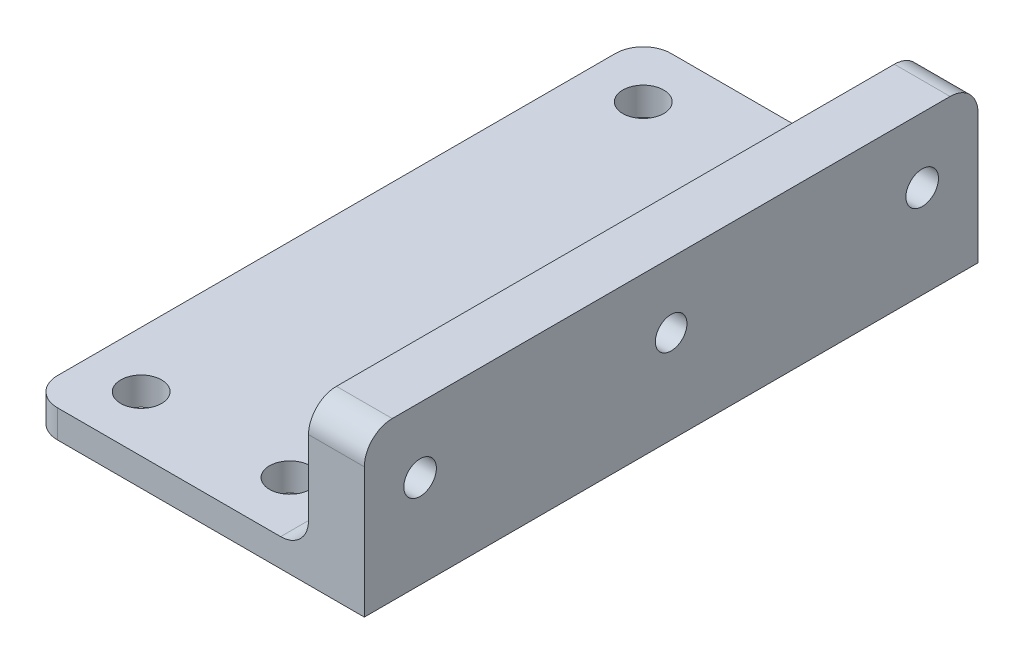
from build123d import *

# Parameters (mm, degrees)
SKETCH1_W           = 36
SKETCH1_H           = 66
SKETCH1_R           = 2.2
BOSS_EXTRUDE1_DEPTH = 3
SKETCH2_W           = 6
SKETCH2_H           = 66
BOSS_EXTRUDE2_DEPTH = 14
SKETCH3_R           = 1.7
SKETCH3_R_2         = 1.752037124
CUT_EXTRUDE1_DEPTH  = 75.464756765
CHAMFER1_SIZE       = 1.7
FILLET1_R           = 3


with BuildPart() as part:
    # Sketch1 → Boss-Extrude1 (new body)
    with BuildSketch(Plane(origin=(0, 0, 0), x_dir=(1, 0, 0), z_dir=(0, 1, 0))):
        with Locations((18, 33)):
            Rectangle(SKETCH1_W, SKETCH1_H)
        with Locations(Location((6, 60, 0), (0, 0, 270))):
            Circle(SKETCH1_R, mode=Mode.SUBTRACT)
        with Locations(Location((6, 6, 0), (0, 0, 90))):
            Circle(SKETCH1_R, mode=Mode.SUBTRACT)
        with Locations(Location((22, 6, 0), (0, 0, 270))):
            Circle(SKETCH1_R, mode=Mode.SUBTRACT)
        with Locations(Location((22, 60, 0), (0, 0, 90))):
            Circle(SKETCH1_R, mode=Mode.SUBTRACT)
    extrude(amount=BOSS_EXTRUDE1_DEPTH)

    # Sketch2 → Boss-Extrude2 (add)
    with BuildSketch(Plane(origin=(0, 3, 0), x_dir=(1, 0, 0), z_dir=(0, 1, 0))):
        with Locations((33, 33)):
            Rectangle(SKETCH2_W, SKETCH2_H)
    extrude(amount=BOSS_EXTRUDE2_DEPTH)

    # Sketch3 → Cut-Extrude1 (cut, through all)
    with BuildSketch(Plane.ZY.offset(-30)):
        with Locations((-33, 10)):
            Circle(SKETCH3_R)
        with Locations((-6, 10)):
            Circle(SKETCH3_R_2)
        with Locations(Location((-60, 10, 0), (0, 0, 180))):
            Circle(SKETCH3_R_2)
    extrude(amount=-CUT_EXTRUDE1_DEPTH, mode=Mode.SUBTRACT)

    # Chamfer1
    chamfer1_edges = [part.edges().sort_by_distance(p)[0] for p in [
        (30, 10, -58.247962876),
        (30, 10, -7.752037124),
        (30, 10, -34.7),
    ]]
    chamfer(chamfer1_edges, length=CHAMFER1_SIZE)

    # Fillet1
    fillet1_edges = [part.edges().sort_by_distance(p)[0] for p in [
        (30, 3, -33),
        (33, 17, -66),
        (33, 17, 0),
        (0, 1.5, -66),
        (0, 1.5, 0),
    ]]
    fillet(fillet1_edges, radius=FILLET1_R)


solid = part.part
